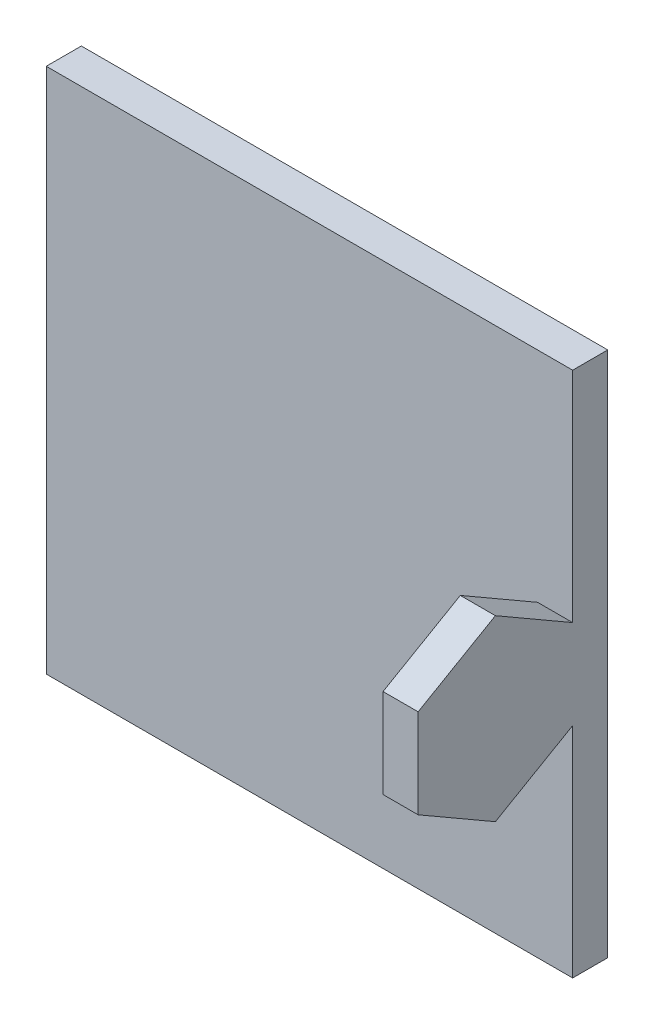
from build123d import *

# Parameters (mm, degrees)
SKETCH1_W           = 95.25
SKETCH1_H           = 95.25
BOSS_EXTRUDE1_DEPTH = 6.35
BOSS_EXTRUDE2_DEPTH = 6.35


with BuildPart() as part:
    # Sketch1 → Boss-Extrude1 (new body)
    with BuildSketch(Plane.XY):
        with Locations((-47.625, 47.625)):
            Rectangle(SKETCH1_W, SKETCH1_H)
    extrude(amount=BOSS_EXTRUDE1_DEPTH)

    # Sketch3 → Boss-Extrude2 (add)
    with BuildSketch(Plane(origin=(0, 0, 0), x_dir=(0, 0, -1), z_dir=(1, 0, 0))):
        Polygon((-6.35, 55.696344872), (-20.329979404, 63.767689744), (-34.309958807, 55.696344872), (-34.309958807, 39.553655128), (-20.329979404, 31.482310256), (-6.35, 39.553655128), align=None)
    extrude(amount=-BOSS_EXTRUDE2_DEPTH)


solid = part.part
